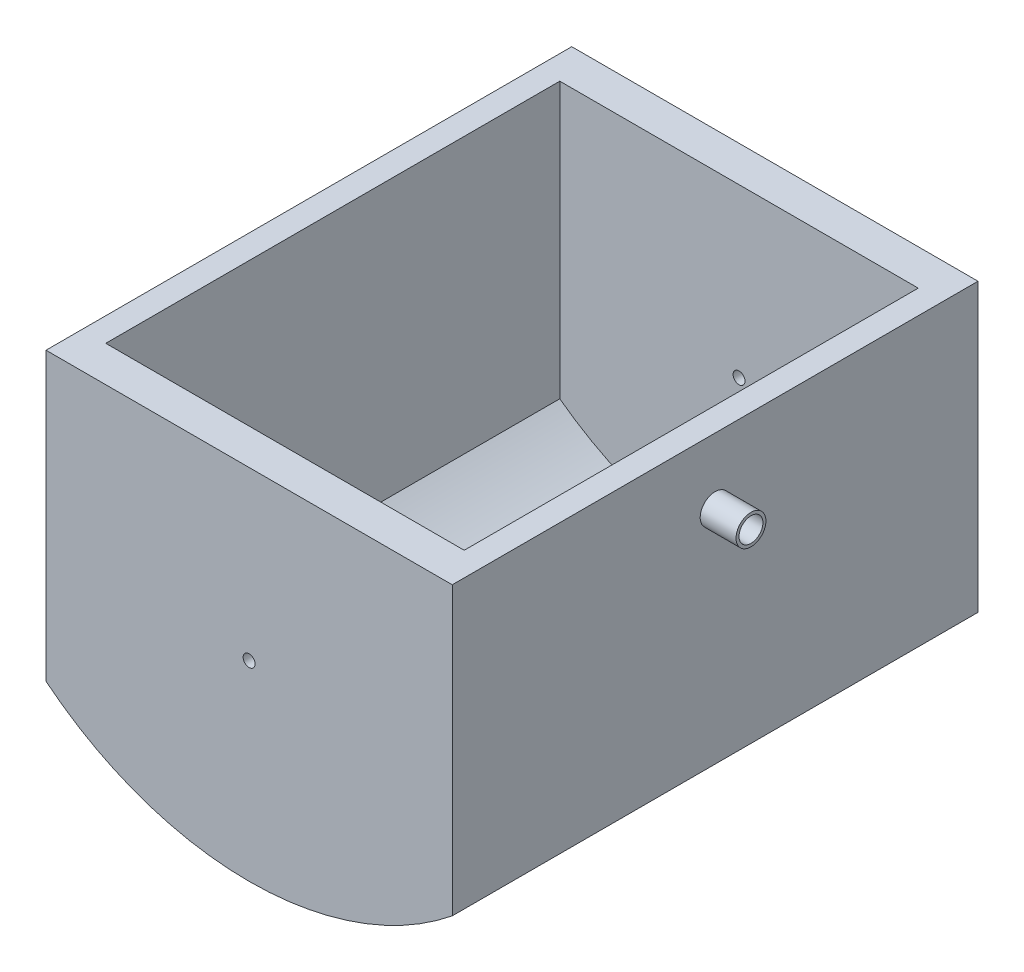
from build123d import *
from build123d.topology import SkipClean

# Parameters (mm, degrees)
SKETCH1_R           = 5
BOSS_EXTRUDE1_DEPTH = 220
CUT_EXTRUDE1_DEPTH  = 190
SKETCH4_R           = 10
CUT_EXTRUDE2_DEPTH  = 190
SKETCH5_R           = 12.5
SKETCH5_R_2         = 10
BOSS_EXTRUDE2_DEPTH = 30


with BuildPart() as part:
    # Sketch1 → Boss-Extrude1 (new, symmetric)
    with BuildSketch(Plane.XY):
        with BuildLine():
            Line((-170, 140), (170, 140))
            Line((170, 140), (170, -100))
            ThreePointArc((170, -100), (0, -160), (-170, -100))
            Line((-170, -100), (-170, 140))
        make_face()
        Circle(SKETCH1_R, mode=Mode.SUBTRACT)
    extrude(amount=BOSS_EXTRUDE1_DEPTH, both=True)

    # Sketch3 → Cut-Extrude1 (cut, symmetric)
    with BuildSketch(Plane.XY):
        with BuildLine():
            Line((-150, 140), (150, 140))
            Line((150, 140), (150, -90.207361828))
            ThreePointArc((150, -90.207361828), (116.45426588, -111.328240908), (80, -126.900469714))
            Line((80, -126.900469714), (80, -159.889880276))
            ThreePointArc((80, -159.889880276), (0, -171.462714083), (-80, -159.889880276))
            Line((-80, -159.889880276), (-80, -126.900469714))
            ThreePointArc((-80, -126.900469714), (-116.45426588, -111.328240908), (-150, -90.207361828))
            Line((-150, -90.207361828), (-150, 140))
        make_face()
    extrude(amount=CUT_EXTRUDE1_DEPTH, both=True, mode=Mode.SUBTRACT)

    # Sketch4 → Cut-Extrude2 (cut, symmetric)
    with BuildSketch(Plane.ZY.offset(-150)):
        with Locations(Location((0, 85, 0), (0, 0, 270))):
            Circle(SKETCH4_R)
    extrude(amount=CUT_EXTRUDE2_DEPTH, both=True, mode=Mode.SUBTRACT)

    # Sketch5 → Boss-Extrude2 (add)
    with SkipClean():  # the faces are left unmerged after this step: merging them gives an invalid solid
        with BuildSketch(Plane(origin=(170, 0, 0), x_dir=(0, 0, -1), z_dir=(1, 0, 0))):
            with Locations(Location((0, 85, 0), (0, 0, 270))):
                Circle(SKETCH5_R)
            with Locations(Location((0, 85, 0), (0, 0, 90))):
                Circle(SKETCH5_R_2, mode=Mode.SUBTRACT)
        extrude(amount=BOSS_EXTRUDE2_DEPTH)


solid = part.part
